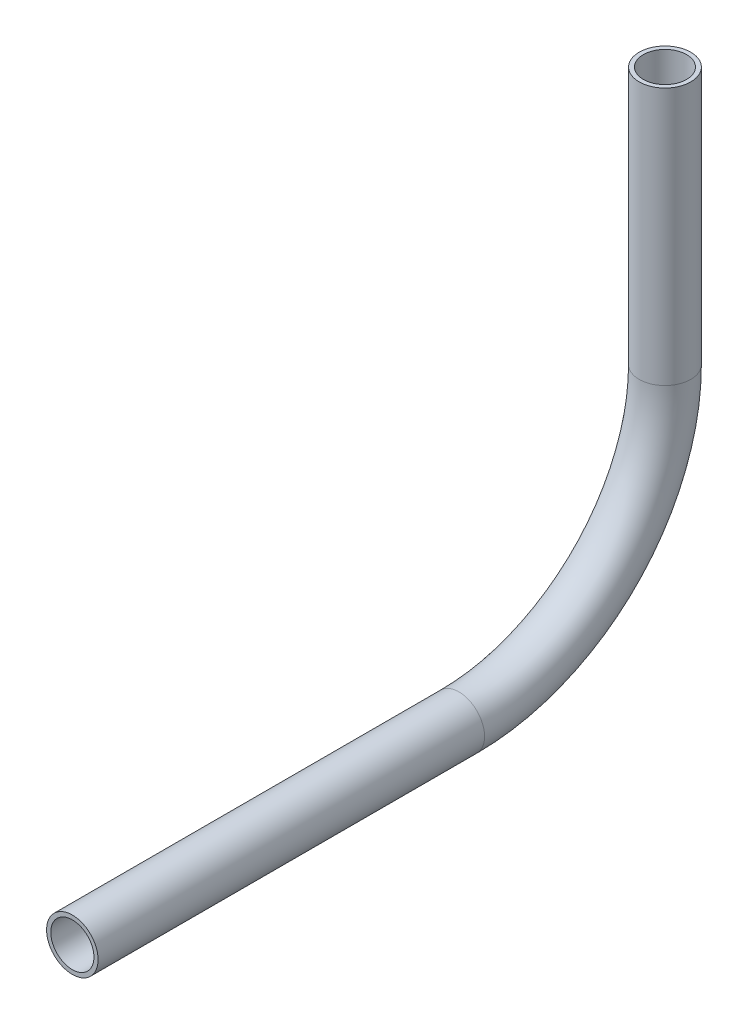
from build123d import *

# Parameters (mm, degrees)
SKETCH2_R = 4
SKETCH3_R = 3.35


with BuildPart() as part:
    # Sweep1: sweep along a path in Sketch1
    with BuildLine(Plane(origin=(0, 0, 0), x_dir=(0, 0, -1), z_dir=(1, 0, 0))) as sweep1_path:
        Line((0, 0), (60, 0))
        ThreePointArc((60, 0), (82.627416998, 9.372583002), (92, 32))
        Line((92, 32), (92, 72))
    # Sketch2 → Sweep1 (sweep)
    with BuildSketch(Plane.XY):
        Circle(SKETCH2_R)
    sweep(path=sweep1_path.line)

    # Cut-Sweep1: sweep along a path in Sketch1<4>
    with BuildLine(Plane(origin=(0, 0, 0), x_dir=(0, 0, -1), z_dir=(1, 0, 0))) as cut_sweep1_path:
        Line((0, 0), (60, 0))
        ThreePointArc((60, 0), (82.627416998, 9.372583002), (92, 32))
        Line((92, 32), (92, 72))
    # Sketch3 → Cut-Sweep1 (sweep, cut)
    with BuildSketch(Plane.XY):
        Circle(SKETCH3_R)
    sweep(path=cut_sweep1_path.line, mode=Mode.SUBTRACT)


solid = part.part
